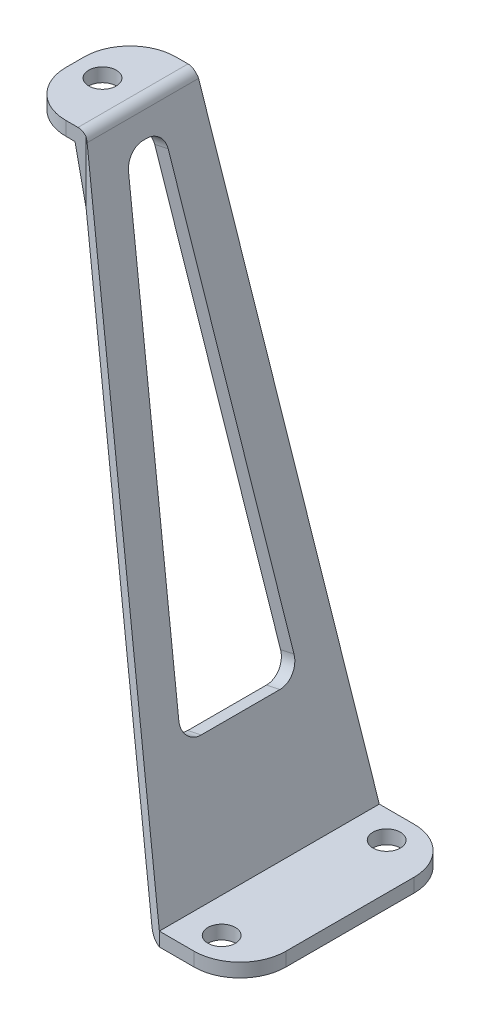
from build123d import *

# Parameters (mm, degrees)
BOSS_EXTRUDE1_DEPTH = 12
SKETCH3_R           = 1.5
CUT_EXTRUDE1_DEPTH  = 70.883402894
SKETCH4_R           = 1.5
CUT_EXTRUDE3_DEPTH  = 72.291233683
SKETCH6_OUTSIDE_W   = 47.446
SKETCH6_OUTSIDE_H   = 41.446
CUT_EXTRUDE4_DEPTH  = 95.687327558
FILLET1_R           = 5
FILLET2_R           = 5
FILLET3_R           = 5
FILLET4_R           = 1.1
FILLET5_R           = 1.1
CUT_EXTRUDE5_DEPTH  = 70.883402894
FILLET6_R           = 2
FILLET7_R           = 2
FILLET8_R           = 2
FILLET9_R           = 2


with BuildPart() as part:
    # Sketch2 → Boss-Extrude1 (new, symmetric)
    with BuildSketch(Plane.XY):
        Polygon((-13.986484746, 65.5), (0, 0), (8.8, 0), (8.8, -1.5), (-1.213515254, -1.5), (-15.2, 64), (-21.2, 64), (-21.2, 65.5), align=None)
    extrude(amount=BOSS_EXTRUDE1_DEPTH, both=True)

    # Sketch3 → Cut-Extrude1 (cut, through all)
    with BuildSketch(Plane(origin=(0, 0, 0), x_dir=(1, 0, 0), z_dir=(0, 1, 0))):
        with Locations(Location((3.8, 9, 0), (0, 0, 270))):
            Circle(SKETCH3_R)
        with Locations(Location((3.8, -9, 0), (0, 0, 270))):
            Circle(SKETCH3_R)
    extrude(amount=-CUT_EXTRUDE1_DEPTH, mode=Mode.SUBTRACT)

    # Sketch4 → Cut-Extrude3 (cut, through all)
    with BuildSketch(Plane(origin=(0, 65.5, 0), x_dir=(1, 0, 0), z_dir=(0, 1, 0))):
        with Locations(Location((-18.2, 0, 0), (0, 0, 270))):
            Circle(SKETCH4_R)
    extrude(amount=-CUT_EXTRUDE3_DEPTH, mode=Mode.SUBTRACT)

    # Sketch6 outside → Cut-Extrude4 (cut, through all)
    with BuildSketch(Plane(origin=(0, 90, 0), x_dir=(1, 0, 0), z_dir=(0, 1, 0))):
        with Locations((-6.2, 0)):
            Rectangle(SKETCH6_OUTSIDE_W, SKETCH6_OUTSIDE_H)
        Polygon((-21.2, 6), (-13.986484746, 6), (0, 12), (8.8, 12), (8.8, -12), (0, -12), (-13.986484746, -6), (-21.2, -6), align=None, mode=Mode.SUBTRACT)
    extrude(amount=-CUT_EXTRUDE4_DEPTH, mode=Mode.SUBTRACT)

    # Fillet1
    fillet1_edges = [part.edges().sort_by_distance(p)[0] for p in [
        (8.8, -0.75, 12),
    ]]
    fillet(fillet1_edges, radius=FILLET1_R)

    # Fillet2
    fillet2_edges = [part.edges().sort_by_distance(p)[0] for p in [
        (8.8, -0.75, -12),
    ]]
    fillet(fillet2_edges, radius=FILLET2_R)

    # Fillet3
    fillet3_edges = [part.edges().sort_by_distance(p)[0] for p in [
        (-21.2, 64.75, 6),
        (-21.2, 64.75, -6),
    ]]
    fillet(fillet3_edges, radius=FILLET3_R)

    # Fillet4
    fillet4_edges = [part.edges().sort_by_distance(p)[0] for p in [
        (-1.213515254, -1.5, 0),
    ]]
    fillet(fillet4_edges, radius=FILLET4_R)

    # Fillet5
    fillet5_edges = [part.edges().sort_by_distance(p)[0] for p in [
        (-13.986484746, 65.5, 0),
    ]]
    fillet(fillet5_edges, radius=FILLET5_R)

    # Sketch7 → Cut-Extrude5 (cut, through all)
    with BuildSketch(Plane(origin=(0, 0, 0), x_dir=(0, 0, -1), z_dir=(0.9779527521078789, 0.20882627862562123, 0))):
        Polygon((-6.757100422, 13.69539962), (6.201245399, 13.69539962), (1.722072489, 63.69539962), (-2.277927511, 63.69539962), align=None)
    extrude(amount=-CUT_EXTRUDE5_DEPTH, mode=Mode.SUBTRACT)

    # Fillet6
    fillet6_edges = [part.edges().sort_by_distance(p)[0] for p in [
        (-14.034737832, 62.134471646, -1.722072489),
    ]]
    fillet(fillet6_edges, radius=FILLET6_R)

    # Fillet7
    fillet7_edges = [part.edges().sort_by_distance(p)[0] for p in [
        (-14.034737832, 62.134471646, 2.277927511),
    ]]
    fillet(fillet7_edges, radius=FILLET7_R)

    # Fillet8
    fillet8_edges = [part.edges().sort_by_distance(p)[0] for p in [
        (-3.593423901, 13.236834041, -6.201245399),
    ]]
    fillet(fillet8_edges, radius=FILLET8_R)

    # Fillet9
    fillet9_edges = [part.edges().sort_by_distance(p)[0] for p in [
        (-3.593423901, 13.236834041, 6.757100422),
    ]]
    fillet(fillet9_edges, radius=FILLET9_R)


solid = part.part
